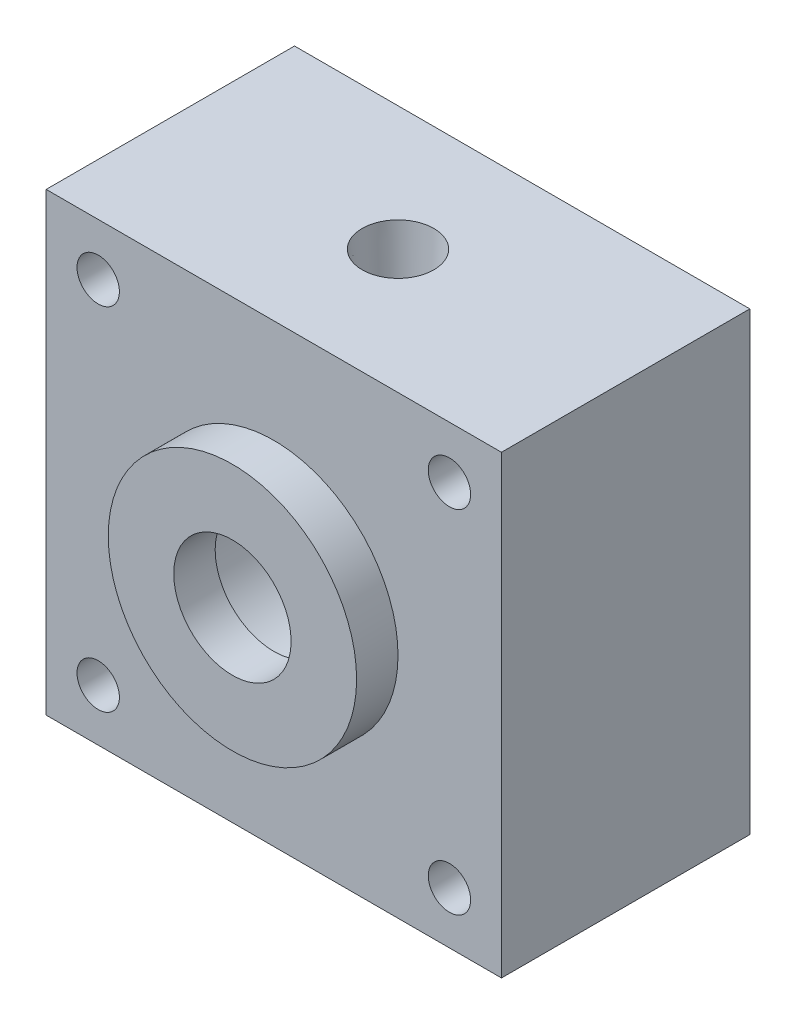
from build123d import *

# Parameters (mm, degrees)
SKETCH1_W           = 34.925
SKETCH1_H           = 34.925
BASE_EXTRUDE_DEPTH  = 19.05
SKETCH12_R          = 15.875
SKETCH12_R_2        = 14.25
CUT_EXTRUDE4_DEPTH  = 1.524
SKETCH3_R           = 1.625
CUT_EXTRUDE2_DEPTH  = 32.189426293
CIRPATTERN2_COUNT   = 4
SKETCH15_R          = 9.525
BOSS_EXTRUDE1_DEPTH = 3.175
SKETCH14_R          = 4.5
CUT_EXTRUDE6_DEPTH  = 34.223913639
CUT_EXTRUDE7_START  = -19.05
SKETCH16_R          = 6.35
CUT_EXTRUDE7_DEPTH  = 19.05


with BuildPart() as part:
    # Sketch1 → Base-Extrude (new body)
    with BuildSketch(Plane.XY):
        Rectangle(SKETCH1_W, SKETCH1_H)
    extrude(amount=BASE_EXTRUDE_DEPTH)

    # Sketch12 → Cut-Extrude4 (cut)
    with BuildSketch(Plane(origin=(-5.978518985, 12.821273311, 0), x_dir=(-1, 0, 0), z_dir=(0, 0, -1))):
        with Locations((-5.978518985, -12.821273311)):
            Circle(SKETCH12_R)
        with Locations((-5.978518985, -12.821273311)):
            Circle(SKETCH12_R_2, mode=Mode.SUBTRACT)
    extrude(amount=-CUT_EXTRUDE4_DEPTH, mode=Mode.SUBTRACT)

    # Sketch3 → Cut-Extrude2 (cut, through all)
    with BuildSketch(Plane.XY.offset(19.05)):
        with Locations((13.470384182, 13.470384182)):
            Circle(SKETCH3_R)
    cut_extrude2 = extrude(amount=-CUT_EXTRUDE2_DEPTH, mode=Mode.SUBTRACT)

    # CirPattern2: Cut-Extrude2 ×4 about axis
    cirpattern2_axis = Axis((0, 0, 0), (0, 0, 1))
    for i in range(1, CIRPATTERN2_COUNT):
        add(cut_extrude2.rotate(cirpattern2_axis, i * 360 / CIRPATTERN2_COUNT), mode=Mode.SUBTRACT)

    # Sketch10 → Hole3 (revolve, cut)
    with BuildSketch(Plane(origin=(0, 17.4625, 9.525), x_dir=(0, 0, 1), z_dir=(1, 0, 0))):
        Polygon((0, 0), (0, 7.799876674), (2.413, 6.35), (2.413, 4.826), (2.750466794, 0), align=None)
    revolve(axis=Axis((0, 21.469039452, 9.525), (0, -1, 0)), mode=Mode.SUBTRACT)

    # Sketch15 → Boss-Extrude1 (add)
    with BuildSketch(Plane.XY.offset(19.05)):
        with Locations(Location((0, 0, 0), (0, 0, 180))):
            Circle(SKETCH15_R)
    extrude(amount=BOSS_EXTRUDE1_DEPTH)

    # Sketch14 → Cut-Extrude6 (cut, through all)
    with BuildSketch(Plane(origin=(0, 0, 0), x_dir=(-1, 0, 0), z_dir=(0, 0, -1))):
        Circle(SKETCH14_R)
    extrude(amount=-CUT_EXTRUDE6_DEPTH, mode=Mode.SUBTRACT)

    # Sketch16 → Cut-Extrude7 (cut)
    with BuildSketch(Plane(origin=(0, 0, 0), x_dir=(-1, 0, 0), z_dir=(0, 0, -1)).offset(CUT_EXTRUDE7_START)):
        Circle(SKETCH16_R)
    extrude(amount=CUT_EXTRUDE7_DEPTH, mode=Mode.SUBTRACT)

    # Sketch17 → Cut-Revolve1 (revolve, cut)
    with BuildSketch(Plane(origin=(0, 0, 0), x_dir=(0, 0, -1), z_dir=(1, 0, 0))):
        Polygon((-9.525, 11.1125), (-10.514867037, 10.541), (-4.09906217, -0.5715), (-3.109195134, 0), align=None)
    revolve(axis=Axis((0, 11.1125, 9.525), (0, -0.8660254037844396, -0.4999999999999983)), mode=Mode.SUBTRACT)


solid = part.part
